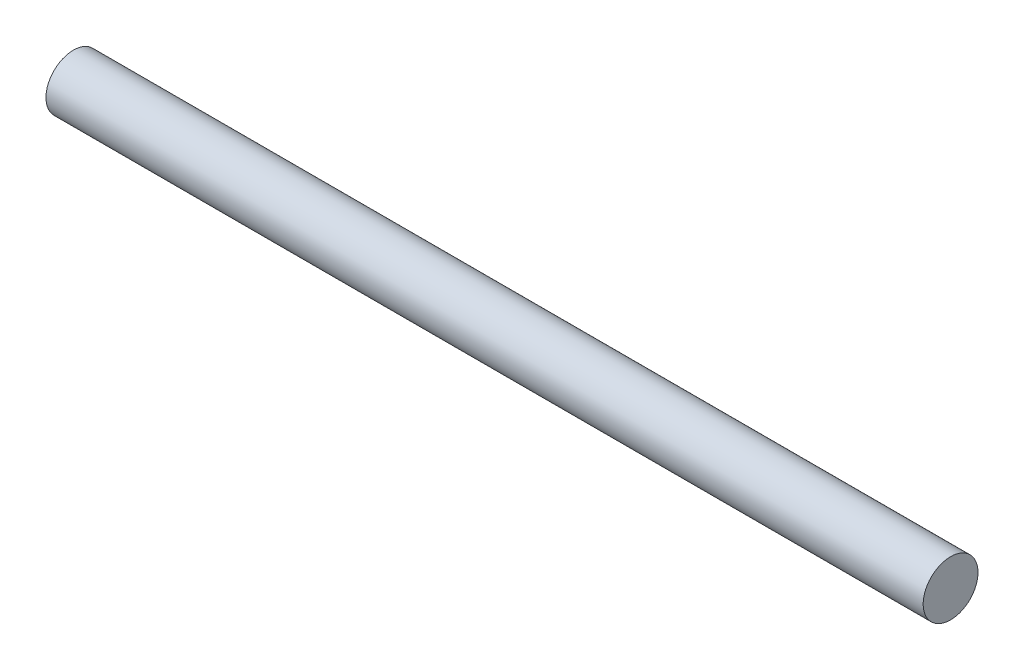
from build123d import *

# Parameters (mm, degrees)
SKETCH1_R           = 3.175
BOSS_EXTRUDE1_DEPTH = 50.8


with BuildPart() as part:
    # Sketch1 → Boss-Extrude1 (new, symmetric)
    with BuildSketch(Plane(origin=(0, 0, 0), x_dir=(0, 0, -1), z_dir=(1, 0, 0))):
        Circle(SKETCH1_R)
    extrude(amount=BOSS_EXTRUDE1_DEPTH, both=True)


solid = part.part
